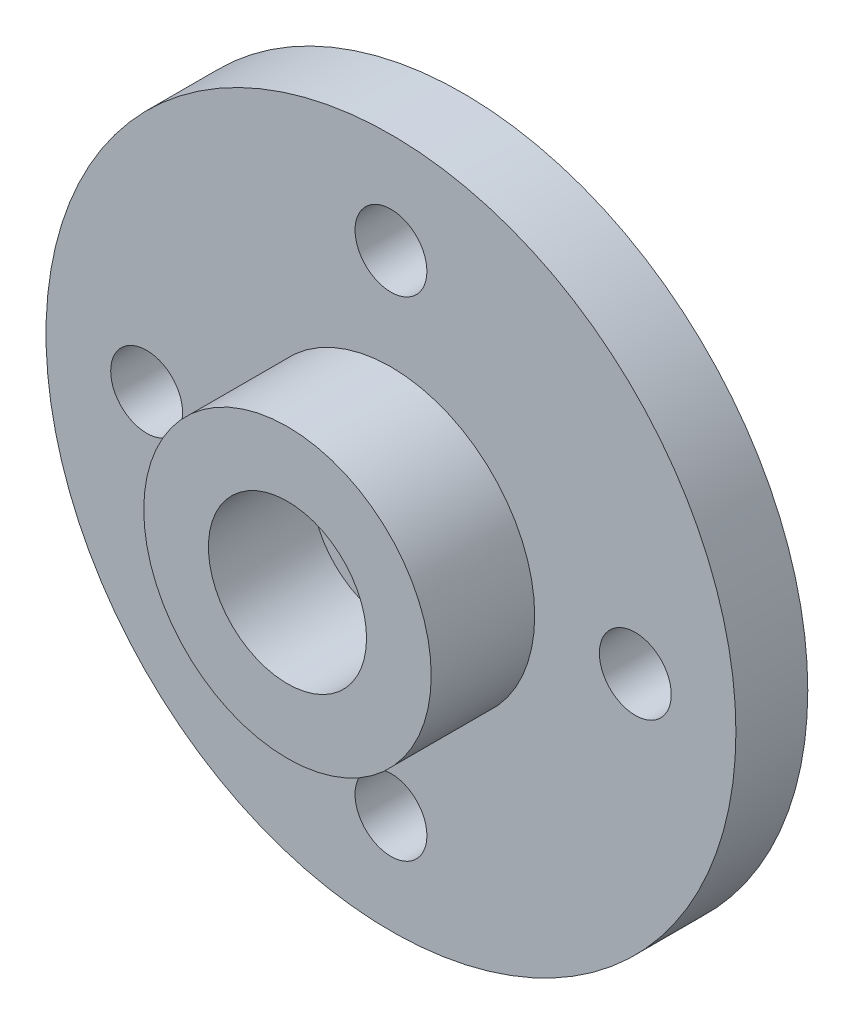
from build123d import *

# Parameters (mm, degrees)
ESQUISSE1_R             = 12
BOSS_EXTRU_1_DEPTH      = 2.5
ESQUISSE2_R             = 5
ESQUISSE2_R_2           = 2.75
BOSS_EXTRU_2_DEPTH      = 3.6
ESQUISSE3_R             = 1.490305946
ESQUISSE3_R_2           = 1.25
ENL_V_MAT_EXTRU_1_DEPTH = 19.033579789


with BuildPart() as part:
    # Esquisse1 → Boss.-Extru.1 (new body)
    with BuildSketch(Plane.XY):
        Circle(ESQUISSE1_R)
    extrude(amount=BOSS_EXTRU_1_DEPTH)

    # Esquisse2 → Boss.-Extru.2 (add)
    with BuildSketch(Plane.XY.offset(2.5)):
        Circle(ESQUISSE2_R)
        Circle(ESQUISSE2_R_2, mode=Mode.SUBTRACT)
    extrude(amount=BOSS_EXTRU_2_DEPTH)

    # Esquisse3 → Enlèv. mat.-Extru.1 (cut, through all)
    with BuildSketch(Plane(origin=(0, 0, 0), x_dir=(-1, 0, 0), z_dir=(0, 0, -1))):
        Circle(ESQUISSE3_R)
        with Locations((0, 8.5)):
            Circle(ESQUISSE3_R_2)
        with Locations((8.5, 0)):
            Circle(ESQUISSE3_R_2)
        with Locations((0, -8.5)):
            Circle(ESQUISSE3_R_2)
        with Locations((-8.5, 0)):
            Circle(ESQUISSE3_R_2)
    extrude(amount=-ENL_V_MAT_EXTRU_1_DEPTH, mode=Mode.SUBTRACT)


solid = part.part
